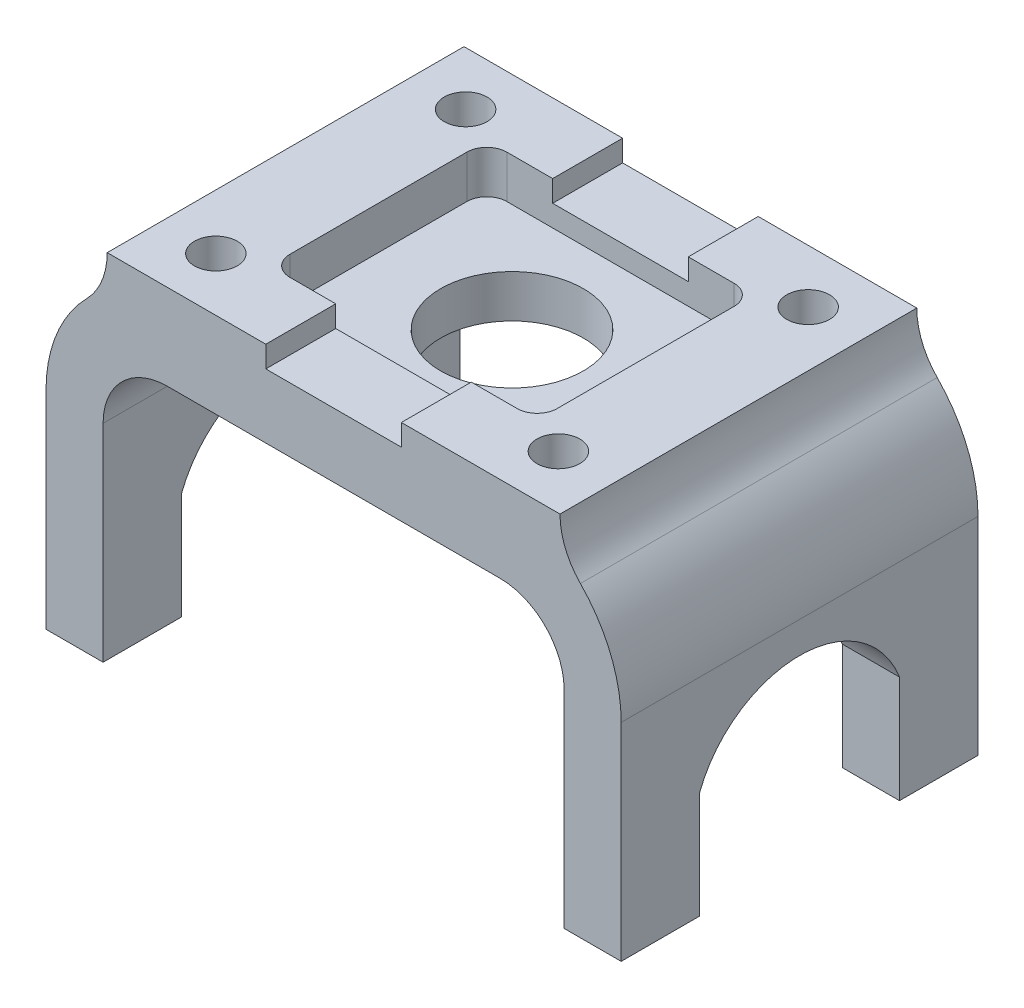
from build123d import *

# Parameters (mm, degrees)
BOSS_EXTRUDE1_DEPTH = 31.75
CUT_EXTRUDE1_DEPTH  = 118.537522281
CUT_EXTRUDE2_DEPTH  = 7.62
SKETCH5_W           = 24.13
SKETCH5_H           = 3.81
CUT_EXTRUDE3_DEPTH  = 95.766937067
CUT_EXTRUDE4_REACH  = 84.159
SKETCH6_R           = 12.7
CUT_EXTRUDE5_REACH  = 89.52
SKETCH7_R           = 3.81


with BuildPart() as part:
    # Sketch2 → Boss-Extrude1 (new, symmetric)
    with BuildSketch(Plane.XY):
        with BuildLine():
            Line((-29.591, 0), (29.591, 0))
            ThreePointArc((29.591, 0), (37.673230509, -3.347769491), (41.021, -11.43))
            Line((41.021, -11.43), (41.021, -48.26))
            Line((41.021, -48.26), (51.181, -48.26))
            Line((51.181, -48.26), (51.181, -11.43))
            ThreePointArc((51.181, -11.43), (49.29585059, -1.827302371), (43.920228208, 6.35))
            ThreePointArc((43.920228208, 6.35), (41.232417018, 10.438651186), (40.289842313, 15.24))
            Line((40.289842313, 15.24), (-40.289842313, 15.24))
            ThreePointArc((-40.289842313, 15.24), (-41.232417018, 10.438651186), (-43.920228208, 6.35))
            ThreePointArc((-43.920228208, 6.35), (-49.29585059, -1.827302371), (-51.181, -11.43))
            Line((-51.181, -11.43), (-51.181, -48.26))
            Line((-51.181, -48.26), (-41.021, -48.26))
            Line((-41.021, -48.26), (-41.021, -11.43))
            ThreePointArc((-41.021, -11.43), (-37.673230509, -3.347769491), (-29.591, 0))
        make_face()
    extrude(amount=BOSS_EXTRUDE1_DEPTH, both=True)

    # Sketch3 → Cut-Extrude1 (cut, through all)
    with BuildSketch(Plane(origin=(51.181, 0, 0), x_dir=(0, 0, -1), z_dir=(1, 0, 0))):
        with BuildLine():
            Line((-17.78, -48.26), (17.78, -48.26))
            Line((17.78, -48.26), (17.78, -29.21))
            ThreePointArc((17.78, -29.21), (0, -16.999159305), (-17.78, -29.21))
            Line((-17.78, -29.21), (-17.78, -48.26))
        make_face()
    extrude(amount=-CUT_EXTRUDE1_DEPTH, mode=Mode.SUBTRACT)

    # Sketch4 → Cut-Extrude2 (cut)
    with BuildSketch(Plane(origin=(0, 15.24, 0), x_dir=(1, 0, 0), z_dir=(0, 1, 0))):
        with BuildLine():
            Line((-20.223842313, 19.304), (20.223842313, 19.304))
            ThreePointArc((20.223842313, 19.304), (22.738314027, 18.262471714), (23.779842313, 15.748))
            Line((23.779842313, 15.748), (23.779842313, -15.748))
            ThreePointArc((23.779842313, -15.748), (22.738314027, -18.262471714), (20.223842313, -19.304))
            Line((20.223842313, -19.304), (-20.223842313, -19.304))
            ThreePointArc((-20.223842313, -19.304), (-22.738314027, -18.262471714), (-23.779842313, -15.748))
            Line((-23.779842313, -15.748), (-23.779842313, 15.748))
            ThreePointArc((-23.779842313, 15.748), (-22.738314027, 18.262471714), (-20.223842313, 19.304))
        make_face()
    extrude(amount=-CUT_EXTRUDE2_DEPTH, mode=Mode.SUBTRACT)

    # Sketch5 → Cut-Extrude3 (cut, through all)
    with BuildSketch(Plane.XY.offset(31.75)):
        with Locations((0, 13.335)):
            Rectangle(SKETCH5_W, SKETCH5_H)
    extrude(amount=-CUT_EXTRUDE3_DEPTH, mode=Mode.SUBTRACT)

    # Sketch6 → Cut-Extrude4 (cut, up to next)
    with BuildSketch(Plane(origin=(0, 7.62, 0), x_dir=(1, 0, 0), z_dir=(0, 1, 0)), mode=Mode.PRIVATE) as cut_extrude4_sk1:
        with Locations(Location((0, 0, 0), (0, 0, 270))):
            Circle(SKETCH6_R)
    cut_extrude4_tool1 = extrude(cut_extrude4_sk1.sketch, amount=-CUT_EXTRUDE4_REACH, mode=Mode.PRIVATE) & part.part
    add(cut_extrude4_tool1.solids().sort_by_distance((0, 7.62, 0))[0], mode=Mode.SUBTRACT)

    # Sketch7 → Cut-Extrude5 (cut, up to next)
    with BuildSketch(Plane(origin=(0, 15.24, 0), x_dir=(1, 0, 0), z_dir=(0, 1, 0)), mode=Mode.PRIVATE) as cut_extrude5_sk1:
        with Locations(Location((-30.48, 22.225, 0), (0, 0, 270))):
            Circle(SKETCH7_R)
    cut_extrude5_tool1 = extrude(cut_extrude5_sk1.sketch, amount=-CUT_EXTRUDE5_REACH, mode=Mode.PRIVATE) & part.part
    # Sketch7 → Cut-Extrude5 (cut, up to next)
    with BuildSketch(Plane(origin=(0, 15.24, 0), x_dir=(1, 0, 0), z_dir=(0, 1, 0)), mode=Mode.PRIVATE) as cut_extrude5_sk2:
        with Locations(Location((30.48, 22.225, 0), (0, 0, 270))):
            Circle(SKETCH7_R)
    cut_extrude5_tool2 = extrude(cut_extrude5_sk2.sketch, amount=-CUT_EXTRUDE5_REACH, mode=Mode.PRIVATE) & part.part
    # Sketch7 → Cut-Extrude5 (cut, up to next)
    with BuildSketch(Plane(origin=(0, 15.24, 0), x_dir=(1, 0, 0), z_dir=(0, 1, 0)), mode=Mode.PRIVATE) as cut_extrude5_sk3:
        with Locations(Location((30.48, -22.225, 0), (0, 0, 270))):
            Circle(SKETCH7_R)
    cut_extrude5_tool3 = extrude(cut_extrude5_sk3.sketch, amount=-CUT_EXTRUDE5_REACH, mode=Mode.PRIVATE) & part.part
    # Sketch7 → Cut-Extrude5 (cut, up to next)
    with BuildSketch(Plane(origin=(0, 15.24, 0), x_dir=(1, 0, 0), z_dir=(0, 1, 0)), mode=Mode.PRIVATE) as cut_extrude5_sk4:
        with Locations(Location((-30.48, -22.225, 0), (0, 0, 270))):
            Circle(SKETCH7_R)
    cut_extrude5_tool4 = extrude(cut_extrude5_sk4.sketch, amount=-CUT_EXTRUDE5_REACH, mode=Mode.PRIVATE) & part.part
    add(cut_extrude5_tool1.solids().sort_by_distance((-30.48, 15.24, -22.225))[0], mode=Mode.SUBTRACT)
    add(cut_extrude5_tool2.solids().sort_by_distance((30.48, 15.24, -22.225))[0], mode=Mode.SUBTRACT)
    add(cut_extrude5_tool3.solids().sort_by_distance((30.48, 15.24, 22.225))[0], mode=Mode.SUBTRACT)
    add(cut_extrude5_tool4.solids().sort_by_distance((-30.48, 15.24, 22.225))[0], mode=Mode.SUBTRACT)


solid = part.part
